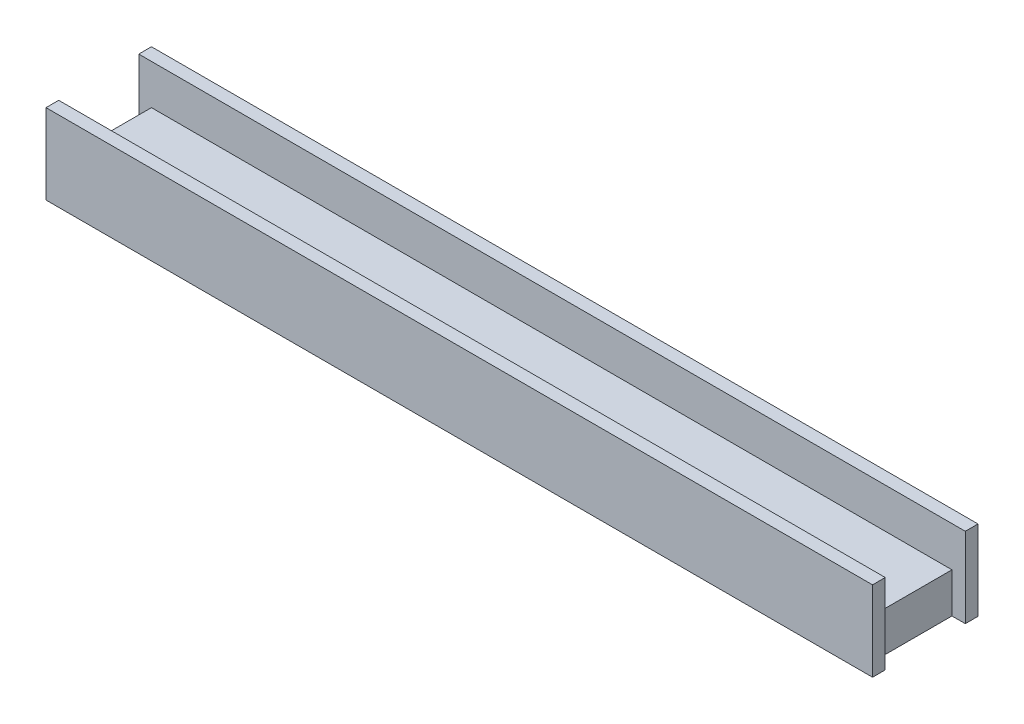
from build123d import *

# Parameters (mm, degrees)
SKETCH1_W             = 50
SKETCH1_H             = 4.999999906
BOSS_EXTRUDE1_DEPTH   = 2.5
SKETCH1_3_W           = 51.6255
SKETCH1_3_H           = 0.79375
BOSS_EXTRUDE2_DEPTH   = 5
BOSS_EXTRUDE2_2_DEPTH = 5


with BuildPart() as part:
    # Sketch1 → Boss-Extrude1 (new body)
    with BuildSketch(Plane(origin=(0, 0, 0), x_dir=(1, 0, 0), z_dir=(0, 1, 0))):
        with Locations((25, -2.499999953)):
            Rectangle(SKETCH1_W, SKETCH1_H)
    extrude(amount=BOSS_EXTRUDE1_DEPTH)


with BuildPart() as body_2:
    # Sketch1<3> → Boss-Extrude2 (new body)
    with BuildSketch(Plane(origin=(0, 0, 0), x_dir=(1, 0, 0), z_dir=(0, 1, 0))):
        with Locations((25.020089004, -5.396874906)):
            Rectangle(SKETCH1_3_W, SKETCH1_3_H)
    extrude(amount=BOSS_EXTRUDE2_DEPTH)


with BuildPart() as body_3:
    # Sketch1<3> → Boss-Extrude2 2 (new body)
    with BuildSketch(Plane(origin=(0, 0, 0), x_dir=(1, 0, 0), z_dir=(0, 1, 0))):
        with Locations((25.020089004, 0.396875)):
            Rectangle(SKETCH1_3_W, SKETCH1_3_H)
    extrude(amount=BOSS_EXTRUDE2_2_DEPTH)


solid = Compound([part.part, body_2.part, body_3.part])
